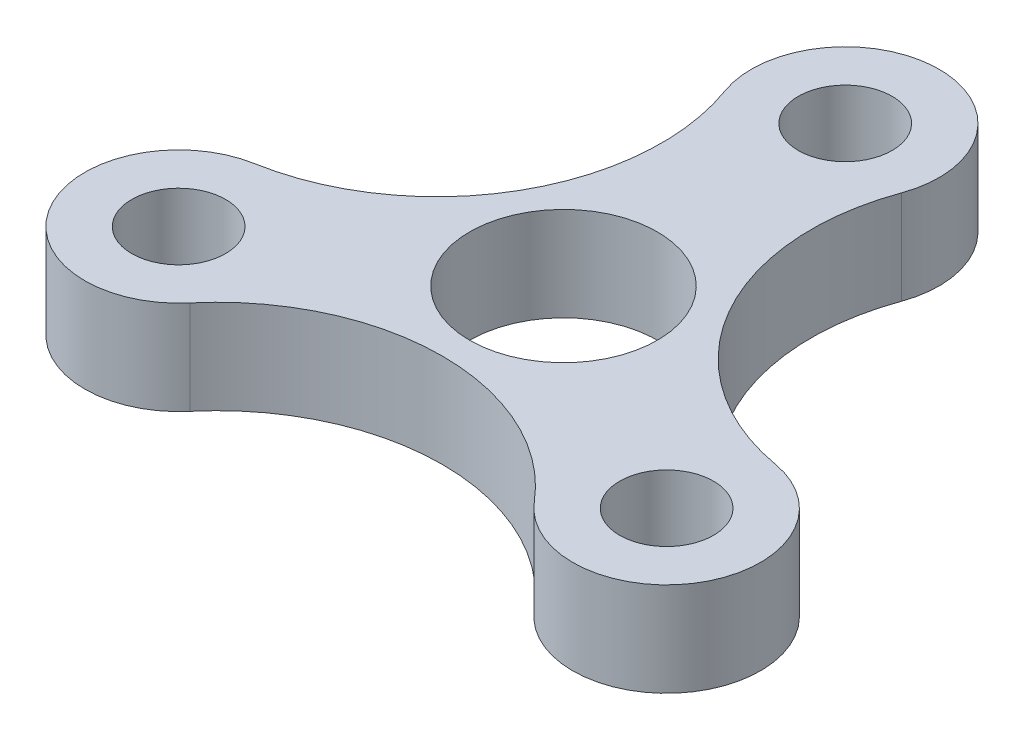
from build123d import *

# Parameters (mm, degrees)
SKETCH1_R           = 10
SKETCH1_R_2         = 5
BOSS_EXTRUDE1_DEPTH = 10


with BuildPart() as part:
    # Sketch1 → Boss-Extrude1 (new body)
    with BuildSketch(Plane(origin=(0, 0, 0), x_dir=(1, 0, 0), z_dir=(0, 1, 0))):
        with BuildLine():
            ThreePointArc((-9.400507195, 26.58965332), (-11.173070065, 6.45077501), (-27.72756885, -5.153748621))
            ThreePointArc((-27.72756885, -5.153748621), (-34.641016151, -20), (-18.327061655, -21.435904699))
            ThreePointArc((-18.327061655, -21.435904699), (0, -12.901550019), (18.327061655, -21.435904699))
            ThreePointArc((18.327061655, -21.435904699), (34.641016151, -20), (27.72756885, -5.153748621))
            ThreePointArc((27.72756885, -5.153748621), (11.173070065, 6.45077501), (9.400507195, 26.58965332))
            ThreePointArc((9.400507195, 26.58965332), (0, 40), (-9.400507195, 26.58965332))
        make_face()
        with Locations(Location((0, 0, 0), (0, 0, 270))):
            Circle(SKETCH1_R, mode=Mode.SUBTRACT)
        with Locations(Location((25.980762114, -15, 0), (0, 0, 270))):
            Circle(SKETCH1_R_2, mode=Mode.SUBTRACT)
        with Locations(Location((0, 30, 0), (0, 0, 270))):
            Circle(SKETCH1_R_2, mode=Mode.SUBTRACT)
        with Locations(Location((-25.980762114, -15, 0), (0, 0, 270))):
            Circle(SKETCH1_R_2, mode=Mode.SUBTRACT)
    extrude(amount=BOSS_EXTRUDE1_DEPTH)


solid = part.part
